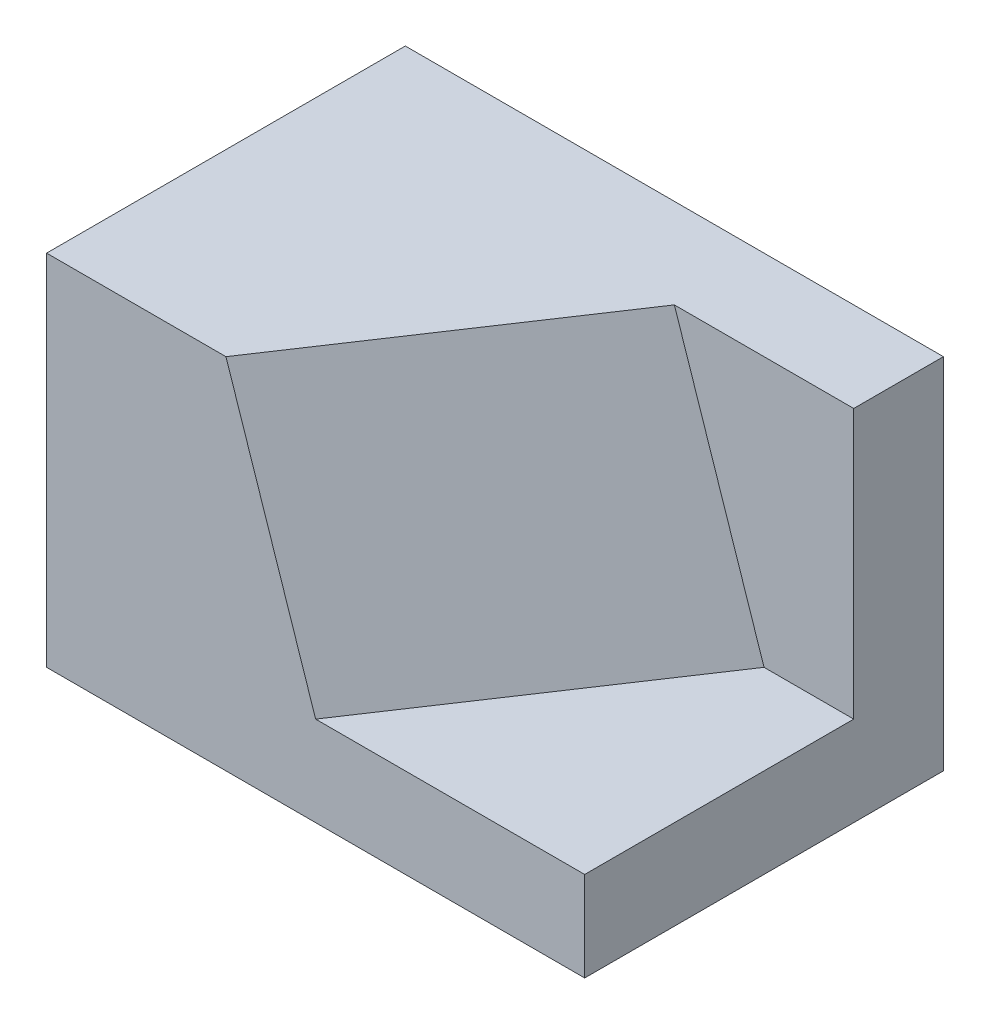
from build123d import *

# Parameters (mm, degrees)
SKETCH1_W           = 60
SKETCH1_H           = 40
BOSS_EXTRUDE1_DEPTH = 10


with BuildPart() as part:
    # Sketch1 → Boss-Extrude1 (new body)
    with BuildSketch(Plane.XY):
        Rectangle(SKETCH1_W, SKETCH1_H)
    extrude(amount=BOSS_EXTRUDE1_DEPTH)

    # Sketch3 → Loft1 section 0
    with BuildSketch(Plane.XY.offset(40)):
        with BuildLine():
            Line((-10, 20), (-30, 20))
            Line((-30, 20), (-30, -20))
            Line((-30, -20), (30, -20))
            Line((30, -20), (30, -10))
            Line((30, -10), (0, -10))
            Line((0, -10), (-10, 20))
        make_face()
    # Sketch2 → Loft1 section 1
    with BuildSketch(Plane.XY.offset(10)):
        with BuildLine():
            Line((-30, -20), (-30, 20))
            Line((-30, 20), (10, 20))
            Line((10, 20), (20, -10))
            Line((20, -10), (30, -10))
            Line((30, -10), (30, -20))
            Line((30, -20), (-30, -20))
        make_face()
    loft()


solid = part.part
